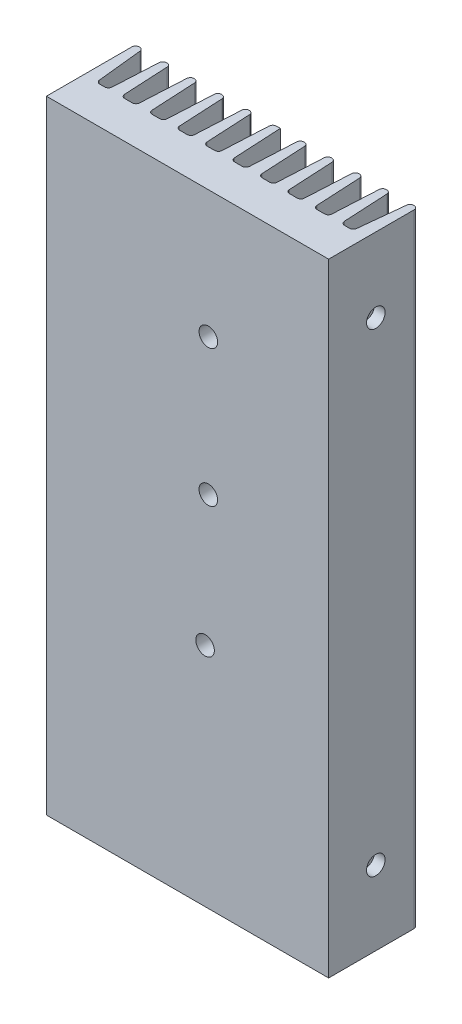
from build123d import *

# Parameters (mm, degrees)
EXTRUDE1_DEPTH            = 83.82
BOSS_EXTRUDE1_DEPTH       = 83.82
LPATTERN1_COUNT           = 9
LPATTERN1_PITCH           = 3.7
FILLET1_R                 = 0.5
FILLET2_R                 = 0.5
M3X0_5_TAPPED_HOLE1_D     = 2.5
M3X0_5_TAPPED_HOLE1_DEPTH = 6.5
M3X0_5_TAPPED_HOLE1_TIP   = 0.751075774
M3X0_5_TAPPED_HOLE2_D     = 2.5
M3X0_5_TAPPED_HOLE2_DEPTH = 5
M3X0_5_TAPPED_HOLE2_TIP   = 0.751075774
M3X0_5_TAPPED_HOLE3_D     = 2.5
M3X0_5_TAPPED_HOLE3_DEPTH = 5
M3X0_5_TAPPED_HOLE3_TIP   = 0.751075774


with BuildPart() as part:
    # Sketch1 → Extrude1 (new body)
    with BuildSketch(Plane(origin=(0, 0, 0), x_dir=(1, 0, 0), z_dir=(0, 1, 0))):
        Polygon((0, 12), (0, 0), (38, 0), (38, 12), (37, 12), (36.264270353, 5), (1.735729647, 5), (1, 12), align=None)
    extrude(amount=EXTRUDE1_DEPTH)

    # Sketch3 → Boss-Extrude1 (add)
    with BuildSketch(Plane(origin=(0, 83.82, 0), x_dir=(1, 0, 0), z_dir=(0, 1, 0))):
        Polygon((3.333145545, 5), (3.7, 12), (4.7, 12), (5.066854455, 5), align=None)
    boss_extrude1 = extrude(amount=-BOSS_EXTRUDE1_DEPTH)

    # LPattern1: Boss-Extrude1 ×9
    with Locations(*[(i * LPATTERN1_PITCH, 0, 0) for i in range(1, LPATTERN1_COUNT)]):
        add(boss_extrude1)

    # Fillet1
    fillet1_edges = [part.edges().sort_by_distance(p)[0] for p in [
        (34.666854455, 41.91, -5),
        (32.933145545, 41.91, -5),
        (1.735729647, 41.91, -5),
        (36.264270353, 41.91, -5),
        (5.066854455, 41.91, -5),
        (3.333145545, 41.91, -5),
        (8.766854455, 41.91, -5),
        (7.033145545, 41.91, -5),
        (12.466854455, 41.91, -5),
        (10.733145545, 41.91, -5),
        (16.166854455, 41.91, -5),
        (14.433145545, 41.91, -5),
        (19.866854455, 41.91, -5),
        (18.133145545, 41.91, -5),
        (23.566854455, 41.91, -5),
        (21.833145545, 41.91, -5),
        (27.266854455, 41.91, -5),
        (25.533145545, 41.91, -5),
        (30.966854455, 41.91, -5),
        (29.233145545, 41.91, -5),
    ]]
    fillet(fillet1_edges, radius=FILLET1_R)

    # Fillet2
    fillet2_edges = [part.edges().sort_by_distance(p)[0] for p in [
        (33.3, 41.91, -12),
        (34.3, 41.91, -12),
        (1, 41.91, -12),
        (37, 41.91, -12),
        (38, 41.91, -12),
        (0, 41.91, -12),
        (3.7, 41.91, -12),
        (4.7, 41.91, -12),
        (7.4, 41.91, -12),
        (8.4, 41.91, -12),
        (11.1, 41.91, -12),
        (12.1, 41.91, -12),
        (14.8, 41.91, -12),
        (15.8, 41.91, -12),
        (18.5, 41.91, -12),
        (22.2, 41.91, -12),
        (23.2, 41.91, -12),
        (25.9, 41.91, -12),
        (26.9, 41.91, -12),
        (29.6, 41.91, -12),
        (30.6, 41.91, -12),
    ]]
    fillet(fillet2_edges, radius=FILLET2_R)

    # M3x0.5 Tapped Hole1
    with Locations(Plane(origin=(38, 0, 0), x_dir=(0, 0, -1), z_dir=(1, 0, 0))):
        with Locations((6.35, 73.82), (6.35, 10)):
            Hole(M3X0_5_TAPPED_HOLE1_D / 2, depth=M3X0_5_TAPPED_HOLE1_DEPTH)
            with Locations((0, 0, -(M3X0_5_TAPPED_HOLE1_DEPTH + M3X0_5_TAPPED_HOLE1_TIP / 2))):  # 118° drill point
                Cone(0, M3X0_5_TAPPED_HOLE1_D / 2, M3X0_5_TAPPED_HOLE1_TIP, mode=Mode.SUBTRACT)

    # M3x0.5 Tapped Hole2
    with Locations(Plane.XY):
        with Locations((21.8, 66.67), (21.8, 48.26)):
            Hole(M3X0_5_TAPPED_HOLE2_D / 2, depth=M3X0_5_TAPPED_HOLE2_DEPTH)
            with Locations((0, 0, -(M3X0_5_TAPPED_HOLE2_DEPTH + M3X0_5_TAPPED_HOLE2_TIP / 2))):  # 118° drill point
                Cone(0, M3X0_5_TAPPED_HOLE2_D / 2, M3X0_5_TAPPED_HOLE2_TIP, mode=Mode.SUBTRACT)

    # M3x0.5 Tapped Hole3
    with Locations(Plane.XY):
        with Locations((21.36, 30.48)):
            Hole(M3X0_5_TAPPED_HOLE3_D / 2, depth=M3X0_5_TAPPED_HOLE3_DEPTH)
            with Locations((0, 0, -(M3X0_5_TAPPED_HOLE3_DEPTH + M3X0_5_TAPPED_HOLE3_TIP / 2))):  # 118° drill point
                Cone(0, M3X0_5_TAPPED_HOLE3_D / 2, M3X0_5_TAPPED_HOLE3_TIP, mode=Mode.SUBTRACT)


solid = part.part
